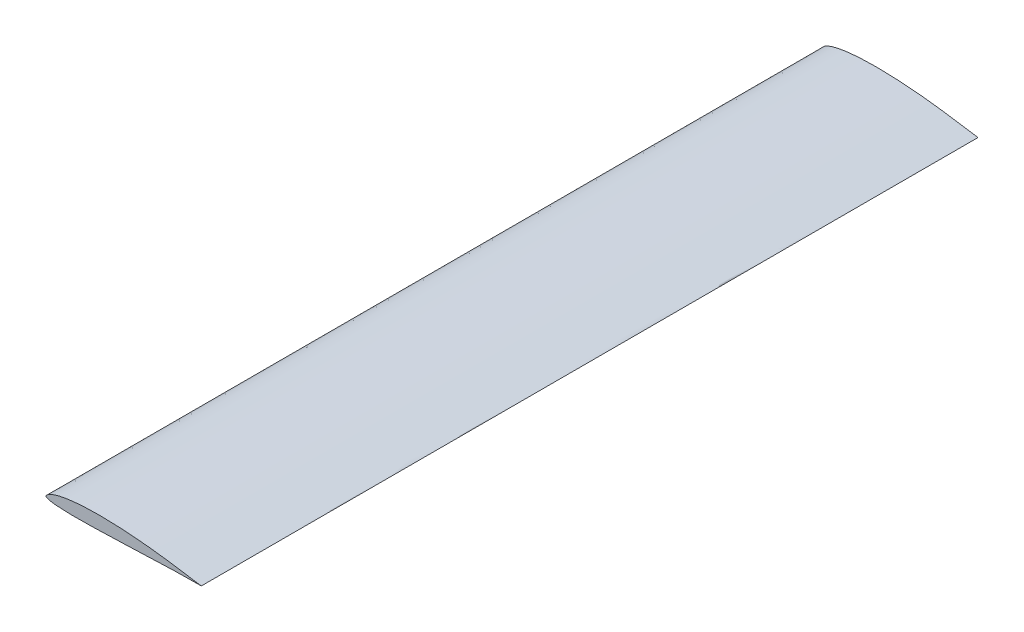
from build123d import *

# Parameters (mm, degrees)
BOSS_EXTRUDE1_DEPTH = 250


with BuildPart() as part:
    # Sketch1 → Boss-Extrude1 (new body)
    with BuildSketch(Plane.XY):
        with BuildLine():
            add(Edge.make_bspline(
                [(50, 0), (50.000127321, 0.002422792), (49.652184009, 0.032958621), (49.301097208, 0.083188509), (48.459274004, 0.194453497), (47.441479646, 0.349875411), (46.133776608, 0.554864154), (44.615485046, 0.799310742), (42.892312753, 1.07508556), (40.995754148, 1.370980431), (38.94771753, 1.674669482), (36.770322955, 1.971115616), (34.483839246, 2.249761345), (32.108990986, 2.504840128), (29.66860858, 2.732239843), (27.188921164, 2.931782342), (24.697141476, 3.099622867), (22.218817139, 3.225155168), (19.778447637, 3.304800695), (17.399570259, 3.338767304), (15.104318179, 3.320960878), (12.913773107, 3.249229887), (10.847546414, 3.129619148), (8.924509706, 2.959577327), (7.161287843, 2.740428866), (5.571517506, 2.476714534), (4.16707883, 2.17390075), (2.957626952, 1.83762559), (1.950465142, 1.477263452), (1.148816473, 1.103045788), (0.558729346, 0.731078994), (0.228075961, 0.436603357), (0.089992171, 0.239435058), (0.040814575, 0.152213957), (0.010449843, 0.073827097), (-0.001543212, 0.012029906), (0.000871812, -0.036665913), (0.024720092, -0.080378542), (0.069417909, -0.130458815), (0.141050471, -0.188547481), (0.314418628, -0.296228741), (0.700511343, -0.453609623), (1.378093814, -0.628171654), (2.337457247, -0.787734756), (3.538967448, -0.918209355), (4.974167945, -1.015410816), (6.631209203, -1.07934352), (8.495610444, -1.110654464), (10.549669024, -1.111991231), (12.77276295, -1.086785548), (15.141440561, -1.038931402), (17.629849017, -0.972256842), (20.210338001, -0.890564709), (22.853820047, -0.797649566), (25.530288492, -0.69692322), (28.20906111, -0.592479053), (30.859040964, -0.487645246), (33.448999851, -0.386619732), (35.947841946, -0.292376734), (38.325016638, -0.208048773), (40.551004266, -0.135849855), (42.596395244, -0.078478019), (44.436055182, -0.036461301), (46.037752375, -0.009148581), (47.398981695, 0.004310281), (48.444054367, 0.00956179), (49.297247507, 0.004211274), (49.651501088, 0.008982102), (49.999872564, -0.00242498), (50, 0)],
                knots=[0, 0, 0, 0, 0.00163101, 0.006435235, 0.014220669, 0.024765625, 0.037826727, 0.053149348, 0.070473504, 0.089535694, 0.110075428, 0.131859875, 0.154692567, 0.178371256, 0.202679512, 0.227363961, 0.252132687, 0.276728351, 0.300939435, 0.324527111, 0.347267377, 0.368991726, 0.389507471, 0.40862838, 0.426224009, 0.442178728, 0.456395551, 0.468805124, 0.479372318, 0.488085518, 0.494967924, 0.50003381, 0.501035663, 0.50209449, 0.502996978, 0.50351288, 0.503955826, 0.504408894, 0.504955423, 0.505942626, 0.507129614, 0.510997735, 0.518231919, 0.527845532, 0.539808758, 0.554055915, 0.570489592, 0.588973674, 0.609342058, 0.631392897, 0.654894034, 0.679589725, 0.705203145, 0.731446604, 0.758020282, 0.784619628, 0.810935624, 0.836656653, 0.861473352, 0.885081475, 0.907187944, 0.927507338, 0.945765257, 0.961711874, 0.975121793, 0.985796266, 0.993581185, 0.998367518, 1, 1, 1, 1], degree=3))
        make_face()
    extrude(amount=BOSS_EXTRUDE1_DEPTH)


solid = part.part
